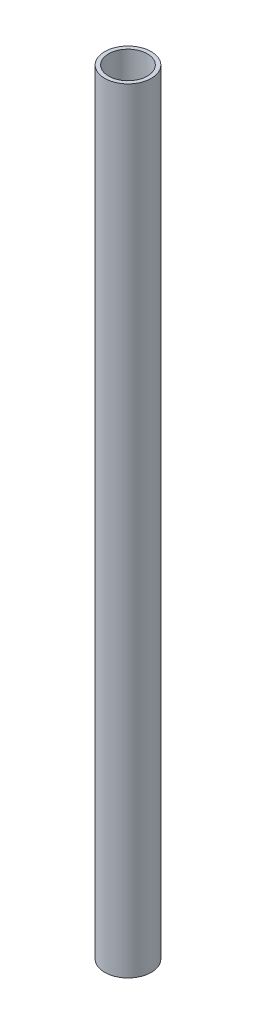
from build123d import *

# Parameters (mm, degrees)
SKETCH1_R           = 6
SKETCH1_R_2         = 5
BOSS_EXTRUDE1_DEPTH = 200


with BuildPart() as part:
    # Sketch1 → Boss-Extrude1 (new body)
    with BuildSketch(Plane(origin=(0, 0, 0), x_dir=(1, 0, 0), z_dir=(0, 1, 0))):
        with Locations(Location((0, 0, 0), (0, 0, 270))):
            Circle(SKETCH1_R)
        with Locations(Location((0, 0, 0), (0, 0, 270))):
            Circle(SKETCH1_R_2, mode=Mode.SUBTRACT)
    extrude(amount=BOSS_EXTRUDE1_DEPTH)


solid = part.part
